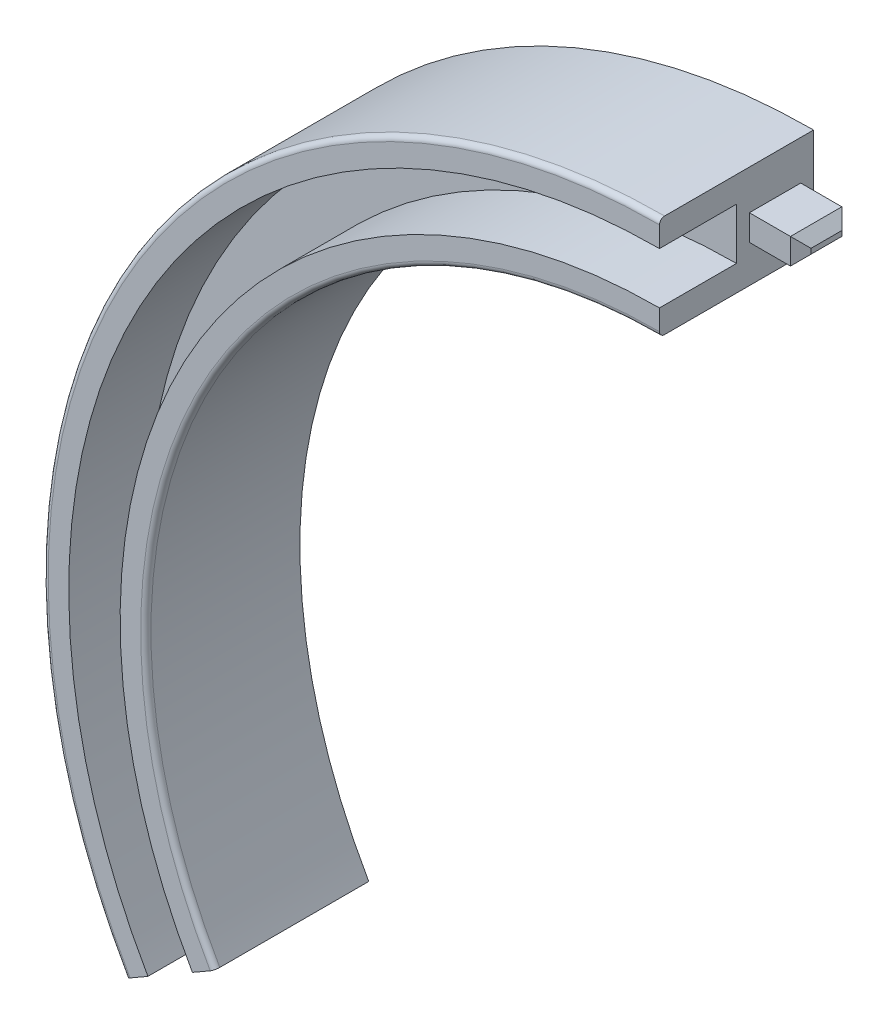
from build123d import *

# Parameters (mm, degrees)
BOSS_EXTRUDE2_DEPTH     = 30
CUT_EXTRUDE1_DEPTH      = 173.336879396
CUT_EXTRUDE1_DEPTH_BACK = 15
SKETCH4_W               = 10
SKETCH4_H               = 5
BOSS_EXTRUDE3_DEPTH     = 10
CHAMFER1_SIZE           = 2
SKETCH6_W               = 5
SKETCH6_H               = 10
CUT_EXTRUDE2_DEPTH      = 10
FILLET1_R               = 1


with BuildPart() as part:
    # Sketch1 → Boss-Extrude2 (new body)
    with BuildSketch(Plane.XY):
        with BuildLine():
            Line((0, 100), (0, 120))
            ThreePointArc((0, 120), (-103.923048454, 60), (-103.923048454, -60))
            Line((-103.923048454, -60), (-86.602540378, -50))
            ThreePointArc((-86.602540378, -50), (-86.602540378, 50), (0, 100))
        make_face()
    extrude(amount=BOSS_EXTRUDE2_DEPTH)

    # Sketch3 → Cut-Extrude1 (cut, two sides: drawn at the far end of the back side and taken through both)
    with BuildSketch(Plane.XY.offset(30).offset(-CUT_EXTRUDE1_DEPTH_BACK)):
        with BuildLine():
            ThreePointArc((-90.932667397, -52.5), (-90.932667397, 52.5), (0, 105))
            Line((0, 105), (0, 115))
            ThreePointArc((0, 115), (-99.592921435, 57.5), (-99.592921435, -57.5))
            Line((-99.592921435, -57.5), (-90.932667397, -52.5))
        make_face()
    extrude(amount=CUT_EXTRUDE1_DEPTH + CUT_EXTRUDE1_DEPTH_BACK, mode=Mode.SUBTRACT)

    # Sketch4 → Boss-Extrude3 (add)
    with BuildSketch(Plane(origin=(0, 0, 0), x_dir=(0, 0, -1), z_dir=(1, 0, 0))):
        with Locations((-7.5, 109.798266437)):
            Rectangle(SKETCH4_W, SKETCH4_H)
    extrude(amount=BOSS_EXTRUDE3_DEPTH)

    # Chamfer1
    chamfer1_edges = [part.edges().sort_by_distance(p)[0] for p in [
        (10, 109.798266437, 2.5),
        (10, 112.298266437, 7.5),
        (10, 109.798266437, 12.5),
        (10, 107.298266437, 7.5),
    ]]
    chamfer(chamfer1_edges, length=CHAMFER1_SIZE)

    # Sketch6 → Cut-Extrude2 (cut)
    with BuildSketch(Plane(origin=(0, 0, 0), x_dir=(0.8660254037844363, 0.5000000000000042, 0), z_dir=(0.5000000000000041, -0.8660254037844362, 0))):
        with Locations((-109.951600937, 7.5)):
            Rectangle(SKETCH6_W, SKETCH6_H)
    extrude(amount=-CUT_EXTRUDE2_DEPTH, mode=Mode.SUBTRACT)

    # Fillet1
    fillet1_edges = [part.edges().sort_by_distance(p)[0] for p in [
        (-86.602540378, 50, 30),
        (-103.923048454, 60, 30),
    ]]
    fillet(fillet1_edges, radius=FILLET1_R)


solid = part.part
